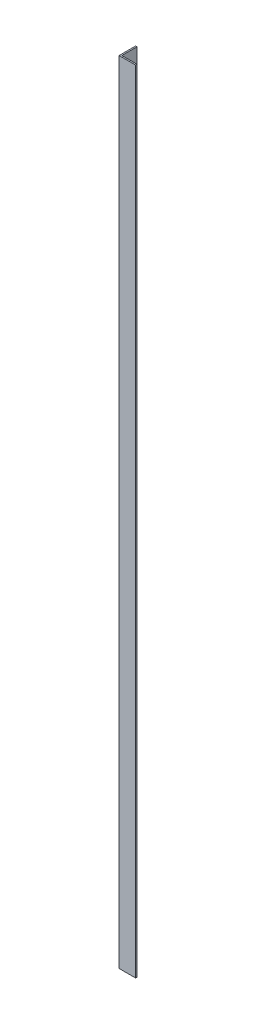
from build123d import *

# Parameters (mm, degrees)
BOSS_EXTRUDE1_DEPTH = 914.4


with BuildPart() as part:
    # Sketch1 → Boss-Extrude1 (new body)
    with BuildSketch(Plane(origin=(0, 0, 0), x_dir=(1, 0, 0), z_dir=(0, 1, 0))):
        Polygon((0, 0), (0, -19.05), (19.05, -19.05), (19.05, -17.4625), (1.5875, -17.4625), (1.5875, 0), align=None)
    extrude(amount=BOSS_EXTRUDE1_DEPTH)


solid = part.part
